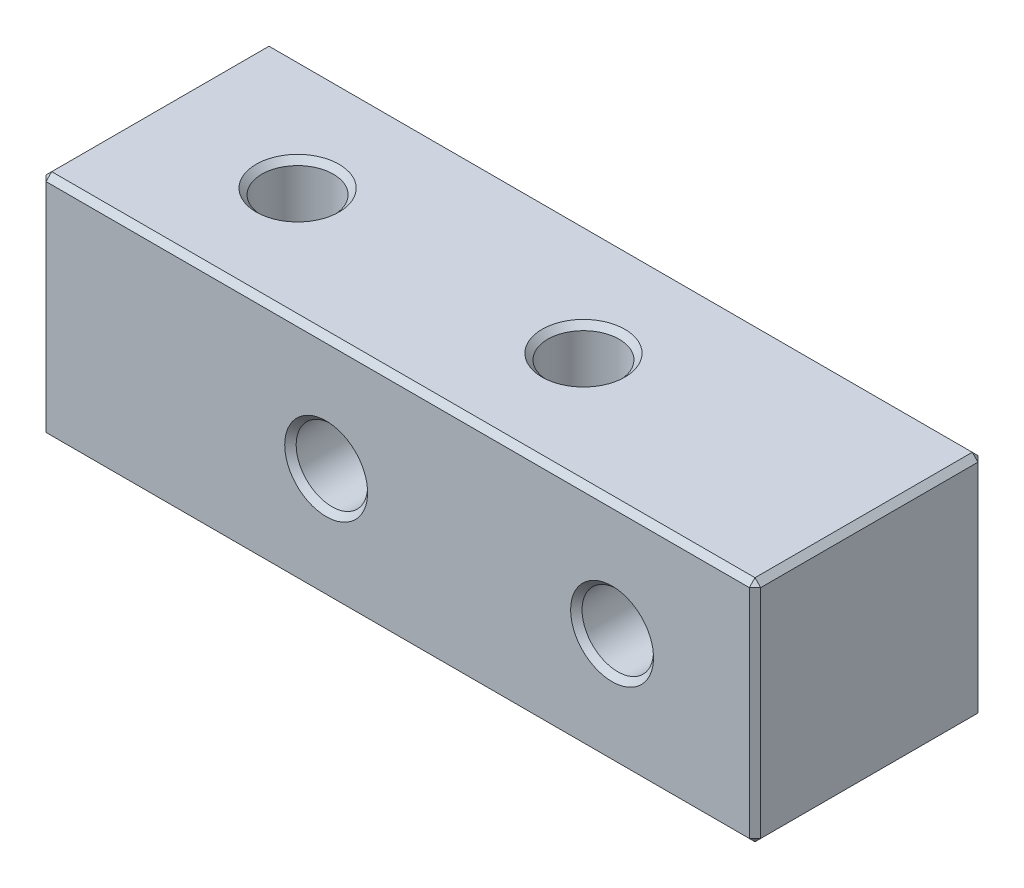
from build123d import *

# Parameters (mm, degrees)
SKETCH_1_W         = 25
SKETCH_1_H         = 8
EXTRUDE_1_DEPTH    = 4
HOLE_WIZARD_M3_1_D = 2.5
HOLE_WIZARD_M3_2_D = 2.5
CHAMFER_1_SIZE     = 0.2


with BuildPart() as part:
    # 草图1 → 凸台-拉伸1 (new, symmetric)
    with BuildSketch(Plane(origin=(0, 0, 0), x_dir=(1, 0, 0), z_dir=(0, 1, 0))):
        Rectangle(SKETCH_1_W, SKETCH_1_H)
    extrude(amount=EXTRUDE_1_DEPTH, both=True)

    # M3 螺纹孔1 (through all)
    with Locations(Plane(origin=(0, 4, 0), x_dir=(1, 0, 0), z_dir=(0, 1, 0))):
        with Locations((-7.5, 0), (2.5, 0)):
            Hole(HOLE_WIZARD_M3_1_D / 2)

    # M3 螺纹孔2 (through all)
    with Locations(Plane(origin=(0, 0, -4), x_dir=(-1, 0, 0), z_dir=(0, 0, -1))):
        with Locations((-7.5, 0), (2.5, 0)):
            Hole(HOLE_WIZARD_M3_2_D / 2)

    # 倒角1
    chamfer_1_edges = [part.edges().sort_by_distance(p)[0] for p in [
        (-12.5, 4, 0),
        (3.75, 4, 0),
        (3.75, -4, 0),
        (0, 4, 4),
        (-6.25, 4, 0),
        (-6.25, -4, 0),
        (-3.75, 0, -4),
        (-3.75, 0, 4),
        (6.25, 0, -4),
        (6.25, 0, 4),
        (12.5, 4, 0),
        (0, -4, 4),
        (-12.5, -4, 0),
        (0, -4, -4),
        (12.5, -4, 0),
        (12.5, 0, 4),
        (-12.5, 0, 4),
        (-12.5, 0, -4),
        (12.5, 0, -4),
        (0, 4, -4),
    ]]
    chamfer(chamfer_1_edges, length=CHAMFER_1_SIZE)


solid = part.part
